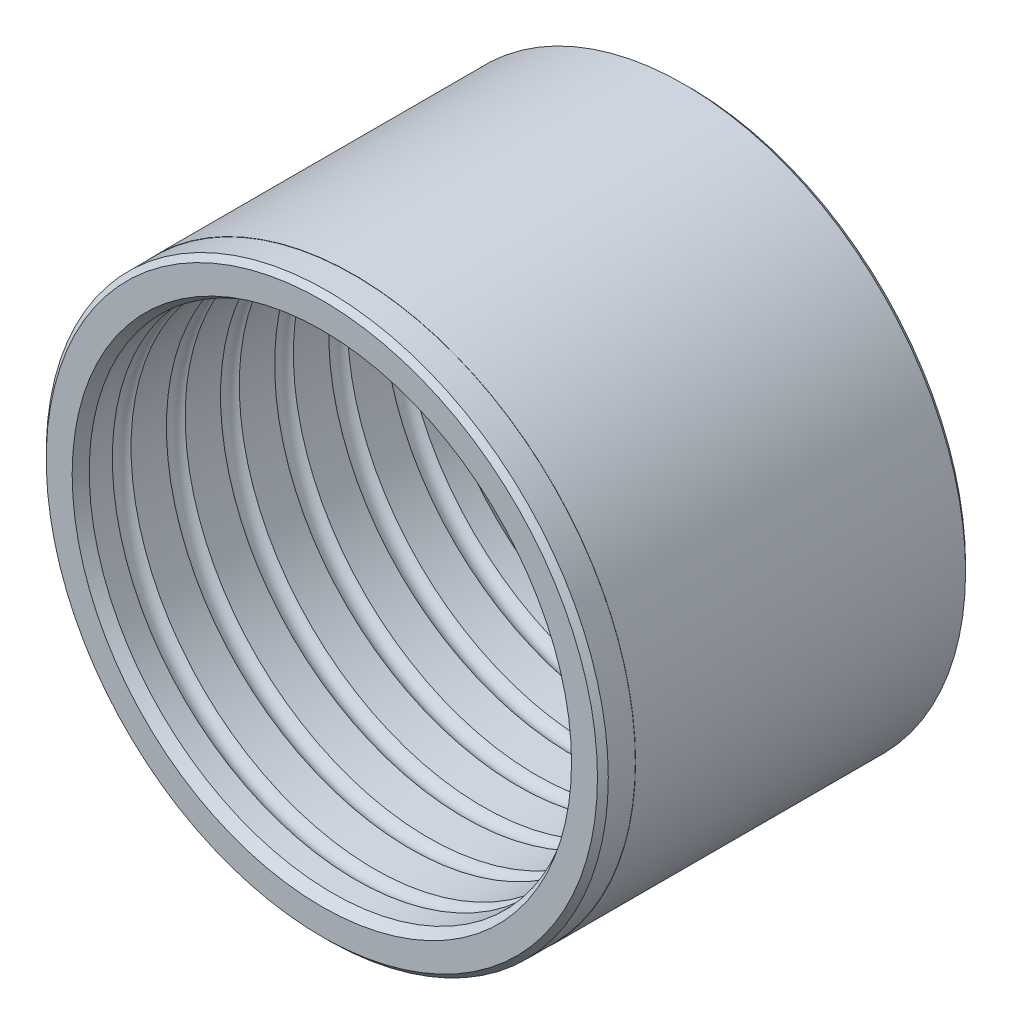
from build123d import *


with BuildPart() as part:
    # Sketch1 → Revolve1 (revolve)
    with BuildSketch(Plane(origin=(0, 0, 0), x_dir=(0, 0, -1), z_dir=(1, 0, 0)), mode=Mode.PRIVATE) as revolve1_sk:
        with BuildLine():
            Line((3, 26), (33.5, 26))
            Line((33.5, 26), (34, 25.5))
            Line((34, 25.5), (34, 24.5))
            Line((34, 24.5), (32, 22.5))
            Line((32, 22.5), (29.866025404, 22.5))
            ThreePointArc((29.866025404, 22.5), (29, 23), (28.133974596, 22.5))
            Line((28.133974596, 22.5), (24.866025404, 22.5))
            ThreePointArc((24.866025404, 22.5), (24, 23), (23.133974596, 22.5))
            Line((23.133974596, 22.5), (19.866025404, 22.5))
            ThreePointArc((19.866025404, 22.5), (19, 23), (18.133974596, 22.5))
            Line((18.133974596, 22.5), (14.866025404, 22.5))
            ThreePointArc((14.866025404, 22.5), (14, 23), (13.133974596, 22.5))
            Line((13.133974596, 22.5), (9.866025404, 22.5))
            ThreePointArc((9.866025404, 22.5), (9, 23), (8.133974596, 22.5))
            Line((8.133974596, 22.5), (4.866025404, 22.5))
            ThreePointArc((4.866025404, 22.5), (4, 23), (3.133974596, 22.5))
            Line((3.133974596, 22.5), (1, 22.5))
            Line((1, 22.5), (0, 23.077350269))
            Line((0, 23.077350269), (0, 25.475))
            Line((0, 25.475), (0.5, 25.975))
            Line((0.5, 25.975), (3, 25.975))
            Line((3, 25.975), (3, 26))
        make_face()
    revolve(revolve1_sk.sketch.rotate(Axis((0, 0, 0), (0, 0, -1)), 90), axis=Axis((0, 0, 0), (0, 0, -1)))


solid = part.part
